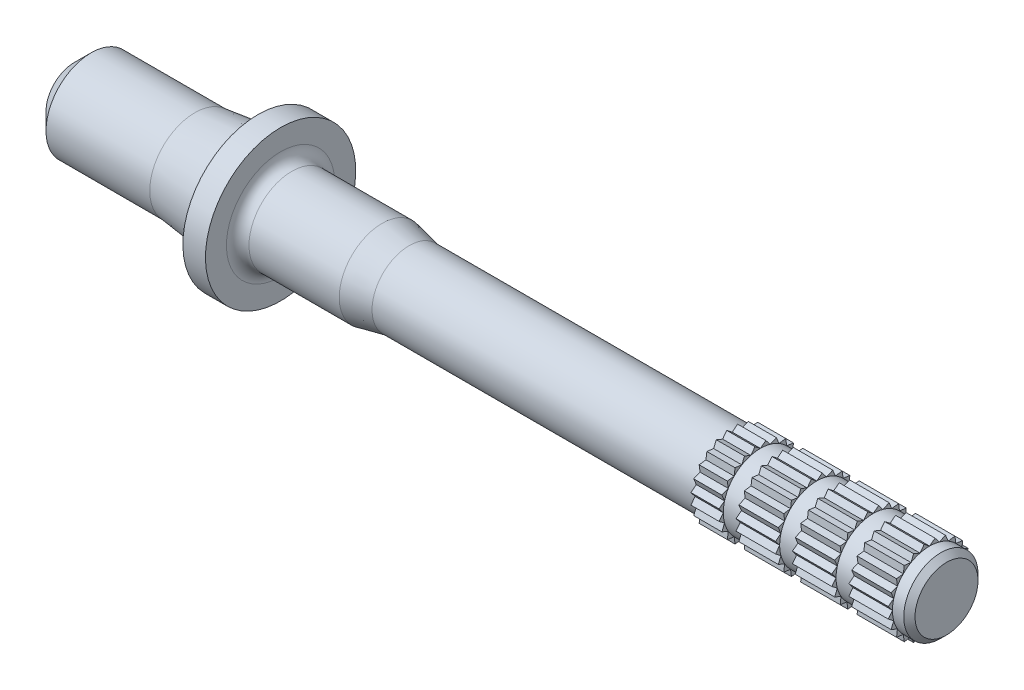
from build123d import *

# Parameters (mm, degrees)
CUT_EXTRUDE1_REACH = 40.956
CIRPATTERN1_COUNT  = 24
SKETCH3_OUTSIDE_W  = 16.622
SKETCH3_OUTSIDE_H  = 16.622
SKETCH3_OUTSIDE_R  = 1.646333965
CUT_EXTRUDE2_DEPTH = 0.75
LPATTERN1_COUNT    = 4
LPATTERN1_PITCH    = 2.5
CHAMFER1_SIZE      = 0.75
CHAMFER2_SIZE      = 0.25
FILLET1_R          = 0.5


with BuildPart() as part:
    # Sketch1 → Revolve1 (revolve)
    with BuildSketch(Plane.XY):
        Polygon((0, 0), (0, 2), (5.35, 2), (8.15, 2.331401839), (8.15, 3.331401839), (9.15, 3.331401839), (9.15, 1.901401839), (13.65, 1.901401839), (14.85, 1.646333965), (29.17, 1.646333965), (29.17, 1.85), (38.67, 1.85), (38.67, 0), align=None)
    revolve(axis=Axis((38.67, 0, 0), (-1, 0, 0)))

    # Sketch2 → Cut-Extrude1 (cut, up to next)
    with BuildSketch(Plane(origin=(38.67, 0, 0), x_dir=(0, 0, -1), z_dir=(1, 0, 0)), mode=Mode.PRIVATE) as cut_extrude1_sk1:
        with BuildLine():
            Line((-0.244307448, 1.833797664), (0, 1.646333965))
            Line((0, 1.646333965), (0, 1.85))
            ThreePointArc((0, 1.85), (-0.122422062, 1.845944972), (-0.244307448, 1.833797664))
        make_face()
    cut_extrude1_tool1 = extrude(cut_extrude1_sk1.sketch, amount=-CUT_EXTRUDE1_REACH, mode=Mode.PRIVATE) & part.part
    # Sketch2 → Cut-Extrude1 (cut, up to next)
    with BuildSketch(Plane(origin=(38.67, 0, 0), x_dir=(0, 0, -1), z_dir=(1, 0, 0)), mode=Mode.PRIVATE) as cut_extrude1_sk2:
        with BuildLine():
            Line((0, 1.85), (0, 1.646333965))
            Line((0, 1.646333965), (0.244307448, 1.833797664))
            ThreePointArc((0.244307448, 1.833797664), (0.122422062, 1.845944972), (0, 1.85))
        make_face()
    cut_extrude1_tool2 = extrude(cut_extrude1_sk2.sketch, amount=-CUT_EXTRUDE1_REACH, mode=Mode.PRIVATE) & part.part
    cut_extrude1_1 = cut_extrude1_tool1.solids().sort_by_distance((38.67, 1.778442, 0.082494))[0]
    add(cut_extrude1_1, mode=Mode.SUBTRACT)
    cut_extrude1_2 = cut_extrude1_tool2.solids().sort_by_distance((38.67, 1.778442, -0.082494))[0]
    add(cut_extrude1_2, mode=Mode.SUBTRACT)
    cut_extrude1 = cut_extrude1_1 + cut_extrude1_2  # Cut-Extrude1 as one shape, for the pattern or mirror that repeats it

    # CirPattern1: Cut-Extrude1 ×24 about axis
    cirpattern1_axis = Axis((0, 0, 0), (1, 0, 0))
    for i in range(1, CIRPATTERN1_COUNT):
        add(cut_extrude1.rotate(cirpattern1_axis, i * 360 / CIRPATTERN1_COUNT), mode=Mode.SUBTRACT)

    # Sketch3 outside → Cut-Extrude2 (cut)
    with BuildSketch(Plane(origin=(38.67, 0, 0), x_dir=(0, 0, -1), z_dir=(1, 0, 0))):
        Rectangle(SKETCH3_OUTSIDE_W, SKETCH3_OUTSIDE_H)
        with Locations(Location((0, 0, 0), (0, 0, 90))):
            Circle(SKETCH3_OUTSIDE_R, mode=Mode.SUBTRACT)
    cut_extrude2 = extrude(amount=-CUT_EXTRUDE2_DEPTH, mode=Mode.SUBTRACT)

    # LPattern1: Cut-Extrude2 ×4
    with Locations(*[(-i * LPATTERN1_PITCH, 0, 0) for i in range(1, LPATTERN1_COUNT)]):
        add(cut_extrude2, mode=Mode.SUBTRACT)

    # Chamfer1
    chamfer1_edges = [part.edges().sort_by_distance(p)[0] for p in [
        (0, -2, 0),
    ]]
    chamfer(chamfer1_edges, length=CHAMFER1_SIZE)

    # Chamfer2
    chamfer2_edges = [part.edges().sort_by_distance(p)[0] for p in [
        (38.67, -1.646333965, 0),
    ]]
    chamfer(chamfer2_edges, length=CHAMFER2_SIZE)

    # Fillet1
    fillet1_edges = [part.edges().sort_by_distance(p)[0] for p in [
        (9.15, -1.901401839, 0),
        (8.15, -2.331401839, 0),
    ]]
    fillet(fillet1_edges, radius=FILLET1_R)


solid = part.part
